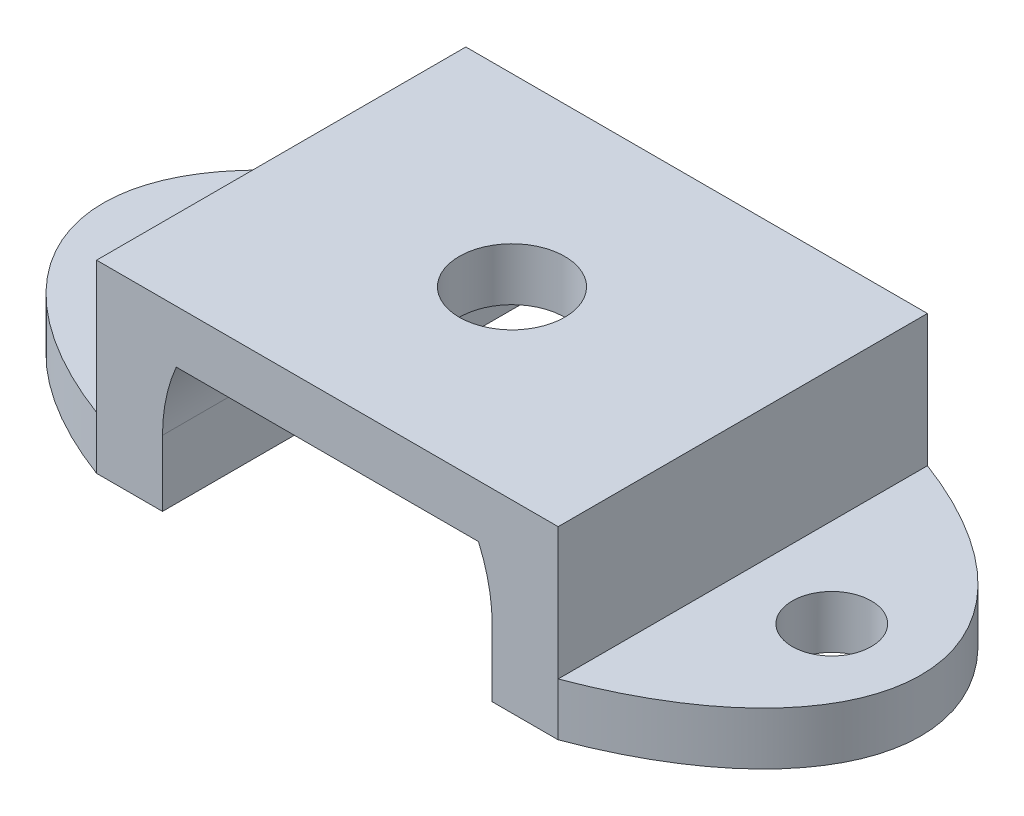
from build123d import *

# Parameters (mm, degrees)
BOSS_EXTRU_1_DEPTH      = 7
ESQUISSE3_R             = 1.5
ENL_V_MAT_EXTRU_2_DEPTH = 8.5
ESQUISSE4_R             = 2
ENL_V_MAT_EXTRU_3_DEPTH = 19.391574158
ENL_V_MAT_EXTRU_4_DEPTH = 18.727097901


with BuildPart() as part:
    # Esquisse1 → Boss.-Extru.1 (new, symmetric)
    with BuildSketch(Plane.XY):
        with BuildLine():
            Line((-15.5, 0), (-6.25, 0))
            Line((-6.25, 0), (-6.25, 2.5))
            ThreePointArc((-6.25, 2.5), (-6.118164456, 3.776935273), (-5.728219619, 5))
            Line((-5.728219619, 5), (5.728219619, 5))
            ThreePointArc((5.728219619, 5), (6.118164456, 3.776935273), (6.25, 2.5))
            Line((6.25, 2.5), (6.25, 0))
            Line((6.25, 0), (15.5, 0))
            Line((15.5, 0), (15.5, 2))
            Line((15.5, 2), (8.75, 2))
            Line((8.75, 2), (8.75, 7))
            Line((8.75, 7), (-8.75, 7))
            Line((-8.75, 7), (-8.75, 2))
            Line((-8.75, 2), (-15.5, 2))
            Line((-15.5, 2), (-15.5, 0))
        make_face()
    extrude(amount=BOSS_EXTRU_1_DEPTH, both=True)

    # Esquisse3 → Enlèv. mat.-Extru.2 (cut)
    with BuildSketch(Plane(origin=(0, 2, 0), x_dir=(1, 0, 0), z_dir=(0, 1, 0))):
        with Locations(Location((-12.125, 0, 0), (0, 0, 180))):
            Circle(ESQUISSE3_R)
        with Locations(Location((12.125, 0, 0), (0, 0, 270))):
            Circle(ESQUISSE3_R)
    extrude(amount=-ENL_V_MAT_EXTRU_2_DEPTH, mode=Mode.SUBTRACT)

    # Esquisse4 → Enlèv. mat.-Extru.3 (cut, through all)
    with BuildSketch(Plane(origin=(0, 7, 0), x_dir=(1, 0, 0), z_dir=(0, 1, 0))):
        with Locations(Location((0, 0, 0), (0, 0, 270))):
            Circle(ESQUISSE4_R)
    extrude(amount=-ENL_V_MAT_EXTRU_3_DEPTH, mode=Mode.SUBTRACT)

    # Esquisse5 → Enlèv. mat.-Extru.4 (cut, through all)
    with BuildSketch(Plane(origin=(0, 2, 0), x_dir=(1, 0, 0), z_dir=(0, 1, 0))):
        with BuildLine():
            add(Edge.make_bspline(
                [(-8.75, 7), (-15.499999991, 4.474226807), (-15.5, 9e-09)],
                knots=[2.170643252, 2.170643252, 2.170643252, 3.141592653, 3.141592653, 3.141592653], degree=2, weights=[1, 0.88445354, 1]))
            Line((-8.75, 7), (-15.5, 7))
            Line((-15.5, 7), (-15.5, 9e-09))
        make_face()
        with BuildLine():
            Line((15.5, 7), (8.75, 7))
            add(Edge.make_bspline(
                [(15.5, 0), (15.5, 4.474226804), (8.75, 7)],
                knots=[0, 0, 0, 0.970949401, 0.970949401, 0.970949401], degree=2, weights=[1, 0.88445354, 1]))
            Line((15.5, 0), (15.5, 7))
        make_face()
        with BuildLine():
            add(Edge.make_bspline(
                [(-15.5, 9e-09), (-15.500000009, -4.474226801), (-8.75, -7)],
                knots=[3.141592653, 3.141592653, 3.141592653, 4.112542055, 4.112542055, 4.112542055], degree=2, weights=[1, 0.88445354, 1]))
            Line((-15.5, 9e-09), (-15.5, -7))
            Line((-15.5, -7), (-8.75, -7))
        make_face()
        with BuildLine():
            Line((15.5, -7), (15.5, 0))
            add(Edge.make_bspline(
                [(8.75, -7), (15.5, -4.474226804), (15.5, 0)],
                knots=[5.312235906, 5.312235906, 5.312235906, 6.283185307, 6.283185307, 6.283185307], degree=2, weights=[1, 0.88445354, 1]))
            Line((8.75, -7), (15.5, -7))
        make_face()
    extrude(amount=-ENL_V_MAT_EXTRU_4_DEPTH, mode=Mode.SUBTRACT)


solid = part.part
